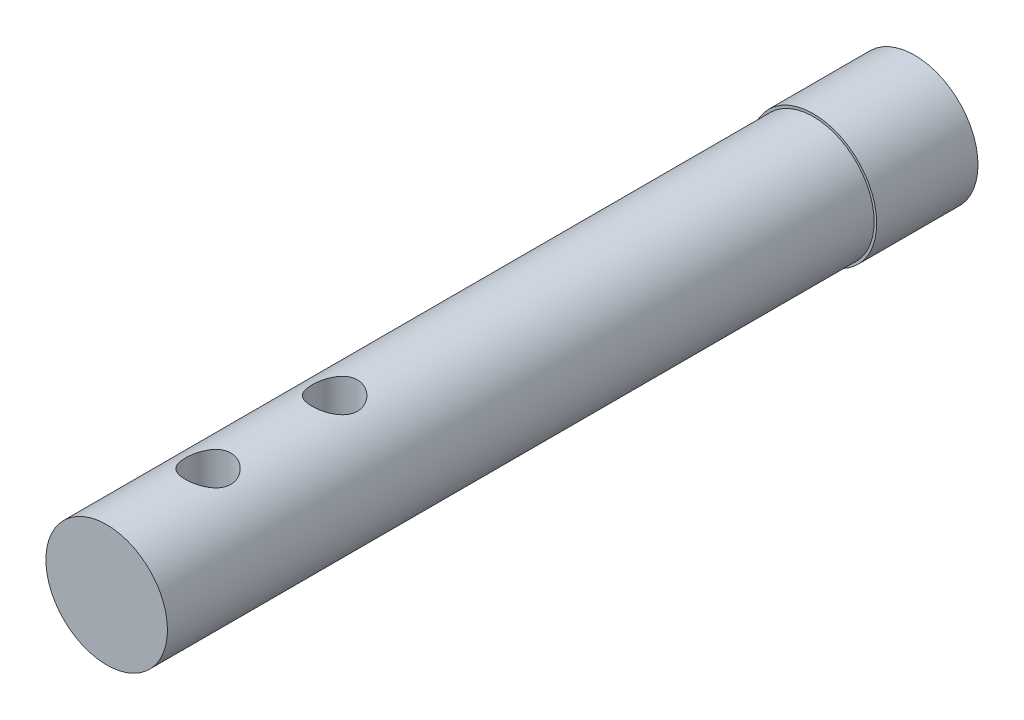
from build123d import *

# Parameters (mm, degrees)
SKETCH1_R               = 10
BOSS_EXTRUDE1_DEPTH     = 15
SKETCH2_R               = 12.5
BOSS_EXTRUDE2_DEPTH     = 20
SKETCH3_R               = 12
BOSS_EXTRUDE3_DEPTH     = 139.5
SKETCH4_R               = 4.5
CUT_EXTRUDE1_DEPTH      = 176.393129854
CUT_EXTRUDE2_DEPTH      = 176.393129954
CUT_EXTRUDE2_DEPTH_BACK = 176.393129954
SKETCH5_W               = 50.129657838
SKETCH5_H               = 19.874218845
LPATTERN1_COUNT         = 2
LPATTERN1_PITCH         = 25


with BuildPart() as part:
    # Sketch1 → Boss-Extrude1 (new body)
    with BuildSketch(Plane.XY):
        Circle(SKETCH1_R)
    extrude(amount=BOSS_EXTRUDE1_DEPTH)

    # Sketch2 → Boss-Extrude2 (add)
    with BuildSketch(Plane.XY.offset(15)):
        Circle(SKETCH2_R)
    extrude(amount=BOSS_EXTRUDE2_DEPTH)

    # Sketch3 → Boss-Extrude3 (add)
    with BuildSketch(Plane.XY.offset(35)):
        Circle(SKETCH3_R)
    extrude(amount=BOSS_EXTRUDE3_DEPTH)

    # Sketch4 → Cut-Extrude1 (cut, symmetric)
    with BuildSketch(Plane(origin=(0, 0, 0), x_dir=(1, 0, 0), z_dir=(0, 1, 0))):
        with Locations(Location((0, -154.5, 0), (0, 0, 270))):
            Circle(SKETCH4_R)
    cut_extrude1 = extrude(amount=CUT_EXTRUDE1_DEPTH, both=True, mode=Mode.SUBTRACT)

    # Sketch5 → Cut-Extrude2 (cut, two sides: drawn at the far end of the back side and taken through both)
    with BuildSketch(Plane(origin=(0, 0, 0), x_dir=(1, 0, 0), z_dir=(0, 1, 0)).offset(-CUT_EXTRUDE2_DEPTH_BACK)):
        with Locations((-12.564828919, -5.062890578)):
            Rectangle(SKETCH5_W, SKETCH5_H)
    extrude(amount=CUT_EXTRUDE2_DEPTH + CUT_EXTRUDE2_DEPTH_BACK, mode=Mode.SUBTRACT)

    # LPattern1: Cut-Extrude1 ×2
    with Locations(*[(0, 0, -i * LPATTERN1_PITCH) for i in range(1, LPATTERN1_COUNT)]):
        add(cut_extrude1, mode=Mode.SUBTRACT)


solid = part.part
